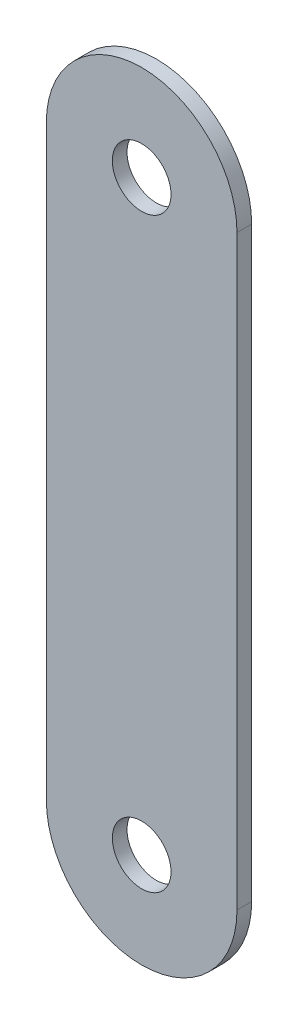
from build123d import *

# Parameters (mm, degrees)
EXTRUDE_1_DEPTH     = 1
SKETCH_2_R          = 2
CUT_EXTRUDE_1_DEPTH = 28.303845883


with BuildPart() as part:
    # 草图1 → 凸台-拉伸1 (new body)
    with BuildSketch(Plane.XY):
        with BuildLine():
            Line((-6.5, -20), (-6.5, 20))
            ThreePointArc((-6.5, 20), (0, 26.5), (6.5, 20))
            Line((6.5, 20), (6.5, -20))
            ThreePointArc((6.5, -20), (0, -26.5), (-6.5, -20))
        make_face()
    extrude(amount=EXTRUDE_1_DEPTH)

    # 草图2 → 切除-拉伸1 (cut, through all)
    with BuildSketch(Plane.XY.offset(1)):
        with Locations((0, -20)):
            Circle(SKETCH_2_R)
        with Locations((0, 20)):
            Circle(SKETCH_2_R)
    extrude(amount=-CUT_EXTRUDE_1_DEPTH, mode=Mode.SUBTRACT)


solid = part.part
